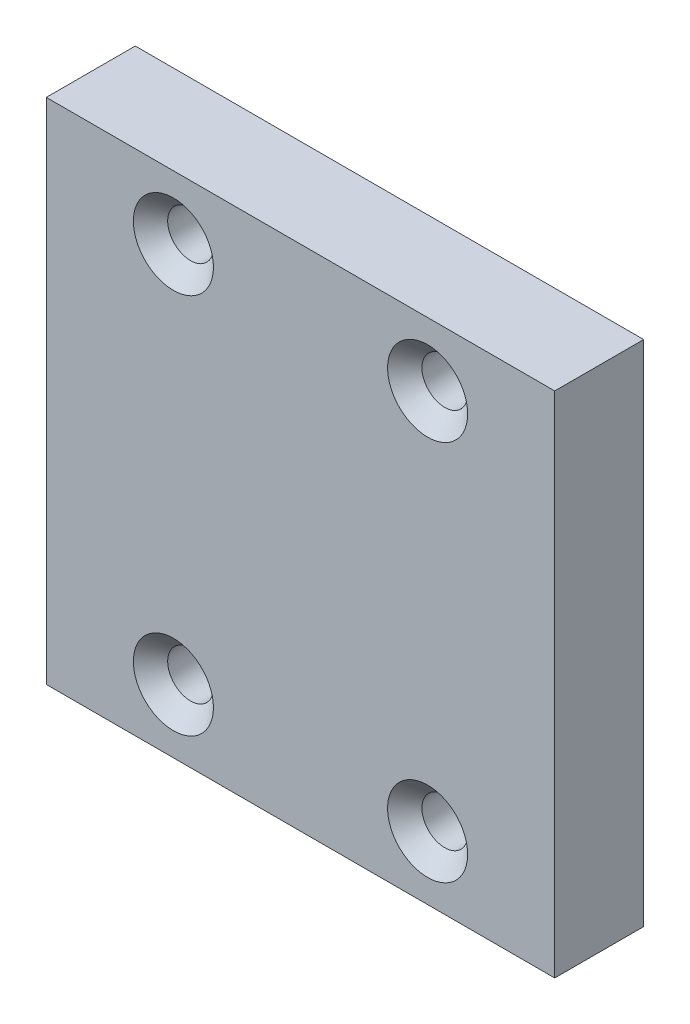
from build123d import *

# Parameters (mm, degrees)
SCHIZZO1_W                   = 40
SCHIZZO1_H                   = 40
ESTRUSIONE_ESTRUSIONE1_DEPTH = 7
RIPETIZIONE_A_L1_COUNT       = 2
RIPETIZIONE_A_L1_PITCH       = 20
RIPETIZIONE_A_L1_COUNT_DIR2  = 2
RIPETIZIONE_A_L1_PITCH_DIR2  = 30


with BuildPart() as part:
    # Schizzo1 → Estrusione-Estrusione1 (new body)
    with BuildSketch(Plane.XY):
        Rectangle(SCHIZZO1_W, SCHIZZO1_H)
    extrude(amount=ESTRUSIONE_ESTRUSIONE1_DEPTH)

    # Schizzo4 → Foro svasato per Vite M3-1 (revolve, cut)
    with BuildSketch(Plane(origin=(-10, 15, 7), x_dir=(0, -1, 0), z_dir=(1, 0, 0))):
        Polygon((0, 0), (0, 11.081549114), (1.8, 10), (1.8, 1.35), (3.15, 0), align=None)
    foro_svasato_per_vite_m3_1 = revolve(axis=Axis((-10, 15, 13.35), (0, 0, -1)), mode=Mode.SUBTRACT)

    # Ripetizione a L1: Foro svasato per Vite M3-1 2 × 2
    with Locations(*[(i * RIPETIZIONE_A_L1_PITCH, -j * RIPETIZIONE_A_L1_PITCH_DIR2, 0) for i in range(RIPETIZIONE_A_L1_COUNT) for j in range(RIPETIZIONE_A_L1_COUNT_DIR2) if (i, j) != (0, 0)]):
        add(foro_svasato_per_vite_m3_1, mode=Mode.SUBTRACT)


solid = part.part
